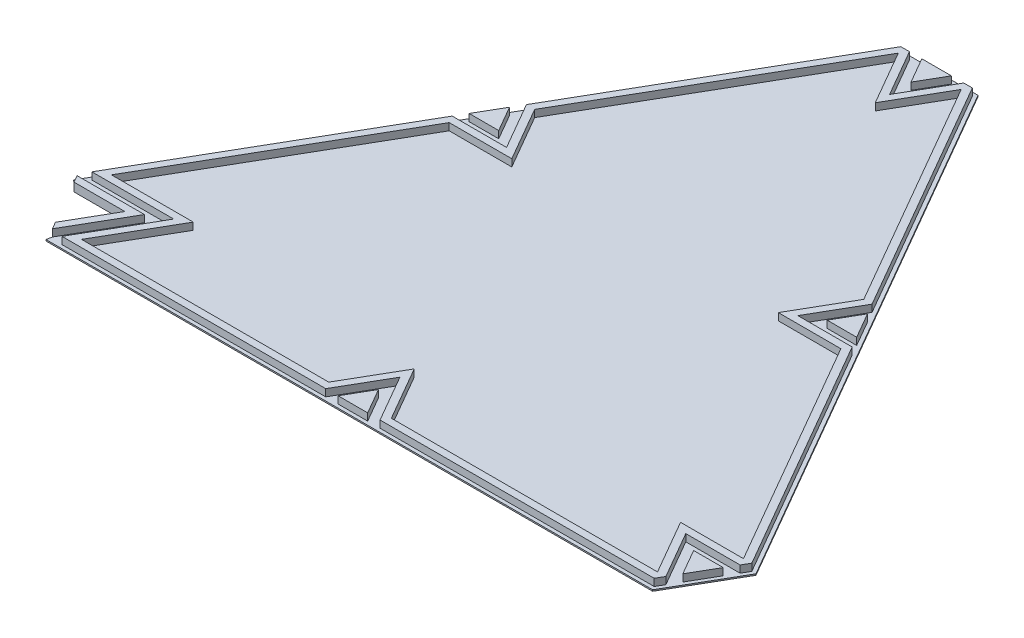
from build123d import *

# Parameters (mm, degrees)
BOSS_EXTRUDE1_DEPTH   = 2.38
BOSS_EXTRUDE1_2_DEPTH = 2.38
BOSS_EXTRUDE1_3_DEPTH = 2.38
BOSS_EXTRUDE1_4_DEPTH = 2.38
BOSS_EXTRUDE1_5_DEPTH = 2.38
BOSS_EXTRUDE1_6_DEPTH = 2.38
BOSS_EXTRUDE1_7_DEPTH = 2.38
BOSS_EXTRUDE4_DEPTH   = 0.38


with BuildPart() as part:
    # Sketch1 → Boss-Extrude1 (new body)
    with BuildSketch(Plane(origin=(0, 0, 0), x_dir=(1, 0, 0), z_dir=(0, 1, 0))):
        Polygon((-85.720943795, 4.071796796), (-84.566243256, 2.071796795), (-75.143593538, 18.392304849), (-93.988892974, 18.392304849), (-92.834192436, 16.392304849), (-78.607695153, 16.392304849), align=None)
    extrude(amount=BOSS_EXTRUDE1_DEPTH)


with BuildPart() as body_2:
    # Sketch1 → Boss-Extrude1 2 (new body)
    with BuildSketch(Plane(origin=(0, 0, 0), x_dir=(1, 0, 0), z_dir=(0, 1, 0))):
        Polygon((-1.08e-07, 8.732050756), (-4.133974466, 1.571796687), (4.133974507, 1.571796687), align=None)
    extrude(amount=BOSS_EXTRUDE1_2_DEPTH)


with BuildPart() as body_3:
    # Sketch1 → Boss-Extrude1 3 (new body)
    with BuildSketch(Plane(origin=(0, 0, 0), x_dir=(1, 0, 0), z_dir=(0, 1, 0))):
        Polygon((91.344555444, 13.812177834), (83.076606252, 13.812177834), (87.210580853, 6.651923788), align=None)
    extrude(amount=BOSS_EXTRUDE1_3_DEPTH)


with BuildPart() as body_4:
    # Sketch1 → Boss-Extrude1 4 (new body)
    with BuildSketch(Plane(origin=(0, 0, 0), x_dir=(1, 0, 0), z_dir=(0, 1, 0))):
        Polygon((50.07179685, 95.458946841), (45.937822254, 88.298692803), (54.205771446, 88.298692803), align=None)
    extrude(amount=BOSS_EXTRUDE1_4_DEPTH)


with BuildPart() as body_5:
    # Sketch1 → Boss-Extrude1 5 (new body)
    with BuildSketch(Plane(origin=(0, 0, 0), x_dir=(1, 0, 0), z_dir=(0, 1, 0))):
        Polygon((4.133974596, 164.865334799), (-4.133974596, 164.865334799), (0, 157.705080761), align=None)
    extrude(amount=BOSS_EXTRUDE1_5_DEPTH)


with BuildPart() as body_6:
    # Sketch1 → Boss-Extrude1 6 (new body)
    with BuildSketch(Plane(origin=(0, 0, 0), x_dir=(1, 0, 0), z_dir=(0, 1, 0))):
        Polygon((-50.071796745, 95.458946839), (-54.205771341, 88.298692801), (-45.937822149, 88.298692801), align=None)
    extrude(amount=BOSS_EXTRUDE1_6_DEPTH)


with BuildPart() as body_7:
    # Sketch1 → Boss-Extrude1 7 (new body)
    with BuildSketch(Plane(origin=(0, 0, 0), x_dir=(1, 0, 0), z_dir=(0, 1, 0))):
        Polygon((-92.834192436, 21.392304849), (-69.947441134, 21.392304849), (-81.390816785, 1.571796811), (-7.598076227, 1.571796811), (5.6e-08, 14.732050972), (7.598076338, 1.571796812), (84.27756817, 1.571796812), (85.478530104, 3.651923899), (77.880453952, 16.812177834), (93.076606256, 16.812177834), (94.277568143, 18.892304841), (55.937822181, 85.298692796), (40.741669759, 85.298692796), (48.33974597, 98.458946834), (10.000000007, 164.865334792), (7.598076211, 164.865334792), (0, 151.705080754), (-7.598076212, 164.865334792), (-9.999999977, 164.865334792), (-48.339745938, 98.458946839), (-40.741669726, 85.298692801), (-55.937822149, 85.298692801), align=None)
        Polygon((-8.752776823, 3.571796679), (-77.926715228, 3.571796679), (-66.4833395, 23.392304849), (-89.370090821, 23.392304849), (-54.783121611, 83.298692801), (-37.277568111, 83.298692801), (-46.030344861, 98.458946839), (-8.799038094, 162.945461791), (0, 147.705080754), (8.799038109, 162.945461817), (46.030344894, 98.458946834), (37.277568144, 83.298692796), (54.783121643, 83.298692796), (92.014428415, 18.812177834), (74.416352337, 18.812177834), (83.2153905, 3.571796679), (8.752776819, 3.571796679), (-2e-09, 18.73205084), align=None, mode=Mode.SUBTRACT)
    extrude(amount=BOSS_EXTRUDE1_7_DEPTH)


    add(body_6.part)  # Boss-Extrude4 merges body 6

    add(body_2.part)  # Boss-Extrude4 merges body 2

    add(body_3.part)  # Boss-Extrude4 merges body 3

    add(body_4.part)  # Boss-Extrude4 merges body 4

    add(body_5.part)  # Boss-Extrude4 merges body 5
    # Sketch1<8> → Boss-Extrude4 (add)
    # profile 1 of 2: a face of its own
    with BuildSketch(Plane(origin=(0, 0, 0), x_dir=(1, 0, 0), z_dir=(0, 1, 0))):
        Polygon((-75.143593538, 18.392304849), (-84.566243256, 2.071796795), (-84.854918391, 0.571796796), (84.85491843, 0.571796796), (95.432268703, 18.892304753), (10.577350242, 165.865334799), (-10.577350242, 165.865334799), (-95.432268647, 18.892304849), (-93.988892974, 18.392304849), align=None)
        Polygon((4.133974507, 1.571796687), (-4.133974466, 1.571796687), (-1.08e-07, 8.732050756), align=None, mode=Mode.SUBTRACT)
        Polygon((87.210580853, 6.651923788), (83.076606252, 13.812177834), (91.344555444, 13.812177834), align=None, mode=Mode.SUBTRACT)
        Polygon((-45.937822149, 88.298692801), (-54.205771341, 88.298692801), (-50.071796745, 95.458946839), align=None, mode=Mode.SUBTRACT)
        Polygon((0, 157.705080761), (-4.133974596, 164.865334799), (4.133974596, 164.865334799), align=None, mode=Mode.SUBTRACT)
        Polygon((-81.390816785, 1.571796811), (-69.947441134, 21.392304849), (-92.834192436, 21.392304849), (-55.937822149, 85.298692801), (-40.741669726, 85.298692801), (-48.339745938, 98.458946839), (-9.999999977, 164.865334792), (-7.598076212, 164.865334792), (0, 151.705080754), (7.598076211, 164.865334792), (10.000000007, 164.865334792), (48.33974597, 98.458946834), (40.741669759, 85.298692796), (55.937822181, 85.298692796), (94.277568143, 18.892304841), (93.076606256, 16.812177834), (77.880453952, 16.812177834), (85.478530104, 3.651923899), (84.27756817, 1.571796812), (7.598076338, 1.571796812), (5.6e-08, 14.732050972), (-7.598076227, 1.571796811), align=None, mode=Mode.SUBTRACT)
        Polygon((54.205771446, 88.298692803), (45.937822254, 88.298692803), (50.07179685, 95.458946841), align=None, mode=Mode.SUBTRACT)
    # profile 2 of 2: a face of its own
    with BuildSketch(Plane(origin=(0, 0, 0), x_dir=(1, 0, 0), z_dir=(0, 1, 0))):
        Polygon((-66.4833395, 23.392304849), (-77.926715228, 3.571796679), (-8.752776823, 3.571796679), (-2e-09, 18.73205084), (8.752776819, 3.571796679), (83.2153905, 3.571796679), (74.416352337, 18.812177834), (92.014428415, 18.812177834), (54.783121643, 83.298692796), (37.277568144, 83.298692796), (46.030344894, 98.458946834), (8.799038109, 162.945461817), (0, 147.705080754), (-8.799038094, 162.945461791), (-46.030344861, 98.458946839), (-37.277568111, 83.298692801), (-54.783121611, 83.298692801), (-89.370090821, 23.392304849), align=None)
    extrude(amount=BOSS_EXTRUDE4_DEPTH)


solid = Compound([part.part, body_7.part])
